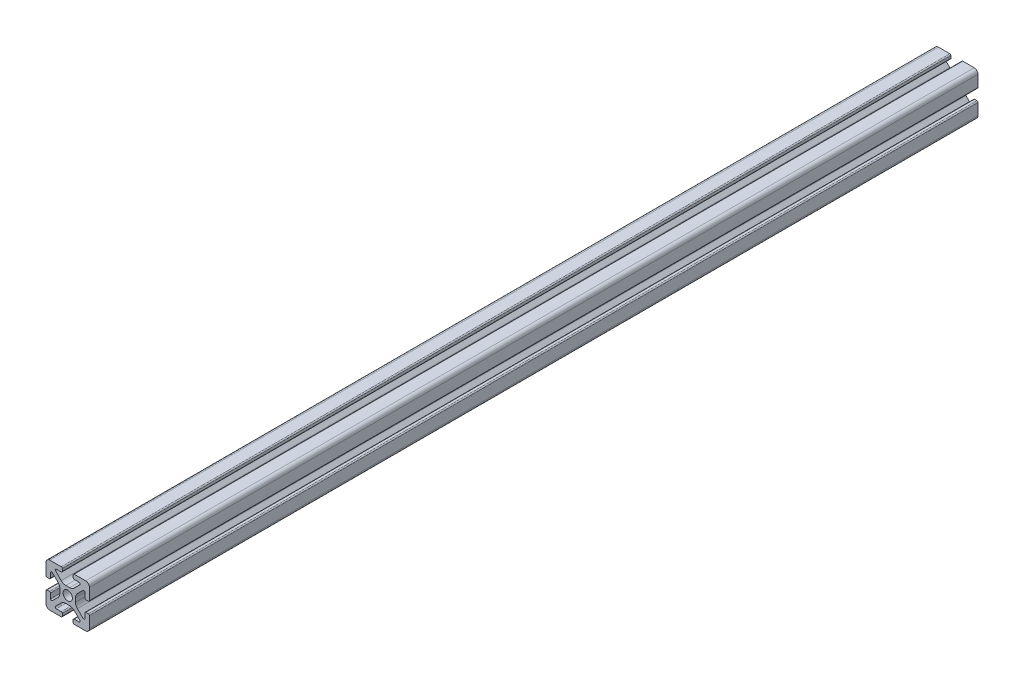
from build123d import *

# Parameters (mm, degrees)
BOSS_EXTRUDE1_DEPTH = 304.8
SKETCH5_W           = 26.995197012
SKETCH5_H           = 24.68705749
CUT_EXTRUDE1_DEPTH  = 200.025


with BuildPart() as part:
    # Sketch4 → Boss-Extrude1 (new, symmetric)
    with BuildSketch(Plane.XY):
        with BuildLine():
            Line((3, -10), (8.25, -10))
            ThreePointArc((8.25, -10), (9.487436867, -9.487436867), (10, -8.25))
            Line((10, -8.25), (10, -3))
            ThreePointArc((10, -3), (9.853553391, -2.646446609), (9.5, -2.5))
            Line((9.5, -2.5), (8.424621202, -2.5))
            ThreePointArc((8.424621202, -2.5), (8.071067812, -2.646446609), (7.924621202, -3))
            Line((7.924621202, -3), (7.924621202, -5.25))
            ThreePointArc((7.924621202, -5.25), (7.615962919, -5.711939766), (7.071067812, -5.603553391))
            Line((7.071067812, -5.603553391), (4.478679656, -3.011165235))
            ThreePointArc((4.478679656, -3.011165235), (3.828361402, -2.037895189), (3.6, -0.889844892))
            Line((3.6, -0.889844892), (3.6, 0))
            Line((3.6, 0), (2.15, 0))
            ThreePointArc((2.15, 0), (1.52027958, -1.52027958), (0, -2.15))
            Line((0, -2.15), (0, -3.6))
            Line((0, -3.6), (0.889844892, -3.6))
            ThreePointArc((0.889844892, -3.6), (2.037895189, -3.828361402), (3.011165235, -4.478679656))
            Line((3.011165235, -4.478679656), (5.603553391, -7.071067812))
            ThreePointArc((5.603553391, -7.071067812), (5.711939766, -7.615962919), (5.25, -7.924621202))
            Line((5.25, -7.924621202), (3, -7.924621202))
            ThreePointArc((3, -7.924621202), (2.646446609, -8.071067812), (2.5, -8.424621202))
            Line((2.5, -8.424621202), (2.5, -9.5))
            ThreePointArc((2.5, -9.5), (2.646446609, -9.853553391), (3, -10))
        make_face()
    extrude(amount=BOSS_EXTRUDE1_DEPTH, both=True)

    # Mirror1: part across plane


with BuildPart() as part_1:
    add(part.part)
    add(part.part.mirror(Plane(origin=(0, 0, 0), x_dir=(0, 0, 1), z_dir=(1, 0, 0))))

    # Mirror2: part across plane


with BuildPart() as part_2:
    add(part_1.part)
    add(part_1.part.mirror(Plane.ZX))

    # Sketch5 → Cut-Extrude1 (cut)
    with BuildSketch(Plane(origin=(0, 0, -304.8), x_dir=(-1, 0, 0), z_dir=(0, 0, -1))):
        with Locations((-0.333544011, -0.025224209)):
            Rectangle(SKETCH5_W, SKETCH5_H)
    extrude(amount=-CUT_EXTRUDE1_DEPTH, mode=Mode.SUBTRACT)


solid = part_2.part
